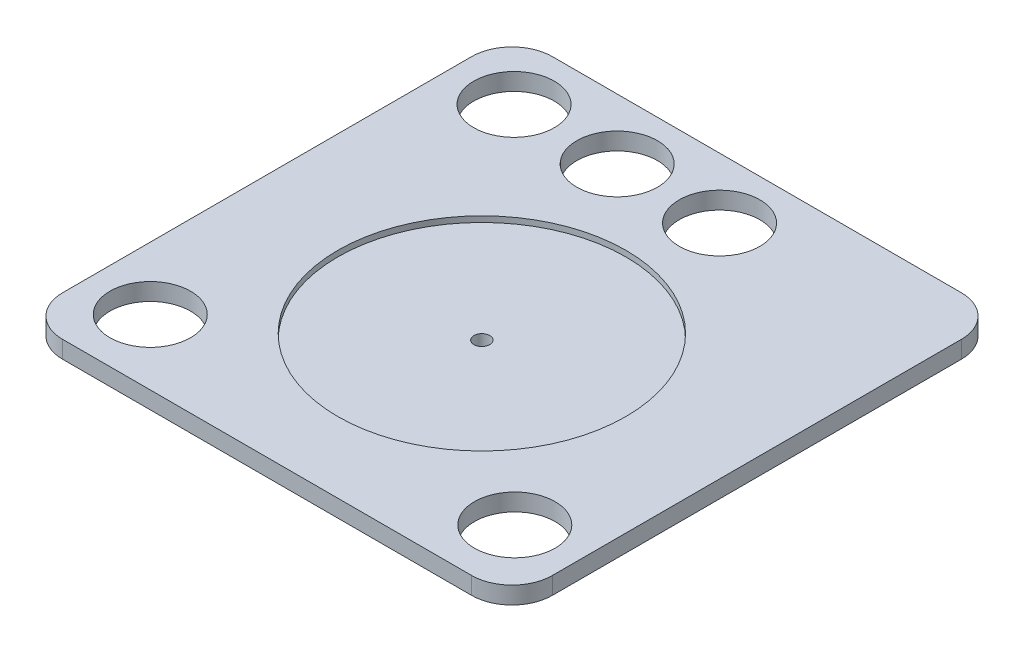
from build123d import *

# Parameters (mm, degrees)
SKETCH1_R           = 25
SKETCH1_R_2         = 7
BOSS_EXTRUDE1_DEPTH = 3
BOSS_EXTRUDE3_START = -2
SKETCH3_R           = 25
BOSS_EXTRUDE3_DEPTH = 2
SKETCH4_R           = 1.375
CUT_EXTRUDE1_DEPTH  = 2


with BuildPart() as part:
    # Sketch1 → Boss-Extrude1 (new body)
    with BuildSketch(Plane(origin=(0, 0, 0), x_dir=(1, 0, 0), z_dir=(0, 1, 0))):
        with BuildLine():
            Line((-32.846869633, -22.461451991), (38.153130367, -22.461451991))
            ThreePointArc((38.153130367, -22.461451991), (43.102877835, -20.411199459), (45.153130367, -15.461451991))
            Line((45.153130367, -15.461451991), (45.153130367, 55.538548009))
            ThreePointArc((45.153130367, 55.538548009), (43.102877835, 60.488295478), (38.153130367, 62.538548009))
            Line((38.153130367, 62.538548009), (-32.846869633, 62.538548009))
            ThreePointArc((-32.846869633, 62.538548009), (-37.796617101, 60.488295478), (-39.846869633, 55.538548009))
            Line((-39.846869633, 55.538548009), (-39.846869633, -15.461451991))
            ThreePointArc((-39.846869633, -15.461451991), (-37.796617101, -20.411199459), (-32.846869633, -22.461451991))
        make_face()
        with Locations(Location((2.653130367, 14.80701719, 0), (0, 0, 270))):
            Circle(SKETCH1_R, mode=Mode.SUBTRACT)
        with Locations(Location((-28.97725989, 52.02421358, 0), (0, 0, 270))):
            Circle(SKETCH1_R_2, mode=Mode.SUBTRACT)
        with Locations(Location((-11.083315318, 52.02421358, 0), (0, 0, 270))):
            Circle(SKETCH1_R_2, mode=Mode.SUBTRACT)
        with Locations(Location((6.69252819, 52.02421358, 0), (0, 0, 270))):
            Circle(SKETCH1_R_2, mode=Mode.SUBTRACT)
        with Locations(Location((-28.97725989, -11.117962427, 0), (0, 0, 270))):
            Circle(SKETCH1_R_2, mode=Mode.SUBTRACT)
        with Locations(Location((34.291639837, -11.117962427, 0), (0, 0, 270))):
            Circle(SKETCH1_R_2, mode=Mode.SUBTRACT)
    extrude(amount=-BOSS_EXTRUDE1_DEPTH)

    # Sketch3 → Boss-Extrude3 (add)
    with BuildSketch(Plane(origin=(0, -3, 0), x_dir=(-1, 0, 0), z_dir=(0, -1, 0)).offset(BOSS_EXTRUDE3_START)):
        with Locations(Location((-2.653130367, 14.80701719, 0), (0, 0, 270))):
            Circle(SKETCH3_R)
    extrude(amount=BOSS_EXTRUDE3_DEPTH)

    # Sketch4 → Cut-Extrude1 (cut)
    with BuildSketch(Plane(origin=(0, -1, 0), x_dir=(1, 0, 0), z_dir=(0, 1, 0))):
        with Locations(Location((2.653130367, 14.80701719, 0), (0, 0, 270))):
            Circle(SKETCH4_R)
    extrude(amount=-CUT_EXTRUDE1_DEPTH, mode=Mode.SUBTRACT)


solid = part.part
